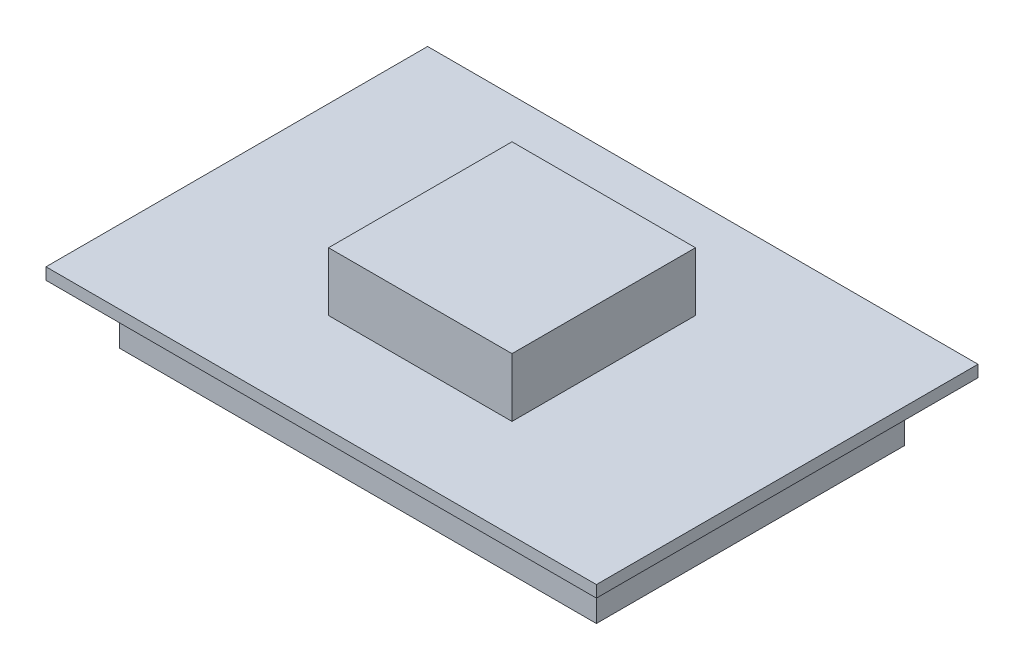
from build123d import *

# Parameters (mm, degrees)
SKETCH1_W        = 75
SKETCH1_H        = 52
ESP32_PCB_DEPTH  = 1.6
SKETCH2_W        = 25
SKETCH2_H        = 25
GNSS_PATCH_DEPTH = 8
SKETCH3_W        = 65
SKETCH3_H        = 42
LIPO_DEPTH       = 8


with BuildPart() as part:
    # Sketch1 → ESP32 PCB (new body)
    with BuildSketch(Plane(origin=(0, -14, 0), x_dir=(1, 0, 0), z_dir=(0, 1, 0))):
        with Locations((-8.5, -123)):
            Rectangle(SKETCH1_W, SKETCH1_H)
    extrude(amount=ESP32_PCB_DEPTH)

    # Sketch2 → GNSS Patch (add)
    with BuildSketch(Plane(origin=(0, -12.4, 0), x_dir=(1, 0, 0), z_dir=(0, 1, 0))):
        with Locations((-8.5, -123)):
            Rectangle(SKETCH2_W, SKETCH2_H)
    extrude(amount=GNSS_PATCH_DEPTH)

    # Sketch3 → LiPo (add)
    with BuildSketch(Plane(origin=(0, -22, 0), x_dir=(1, 0, 0), z_dir=(0, 1, 0))):
        with Locations((-8.5, -123)):
            Rectangle(SKETCH3_W, SKETCH3_H)
    extrude(amount=LIPO_DEPTH)


solid = part.part
